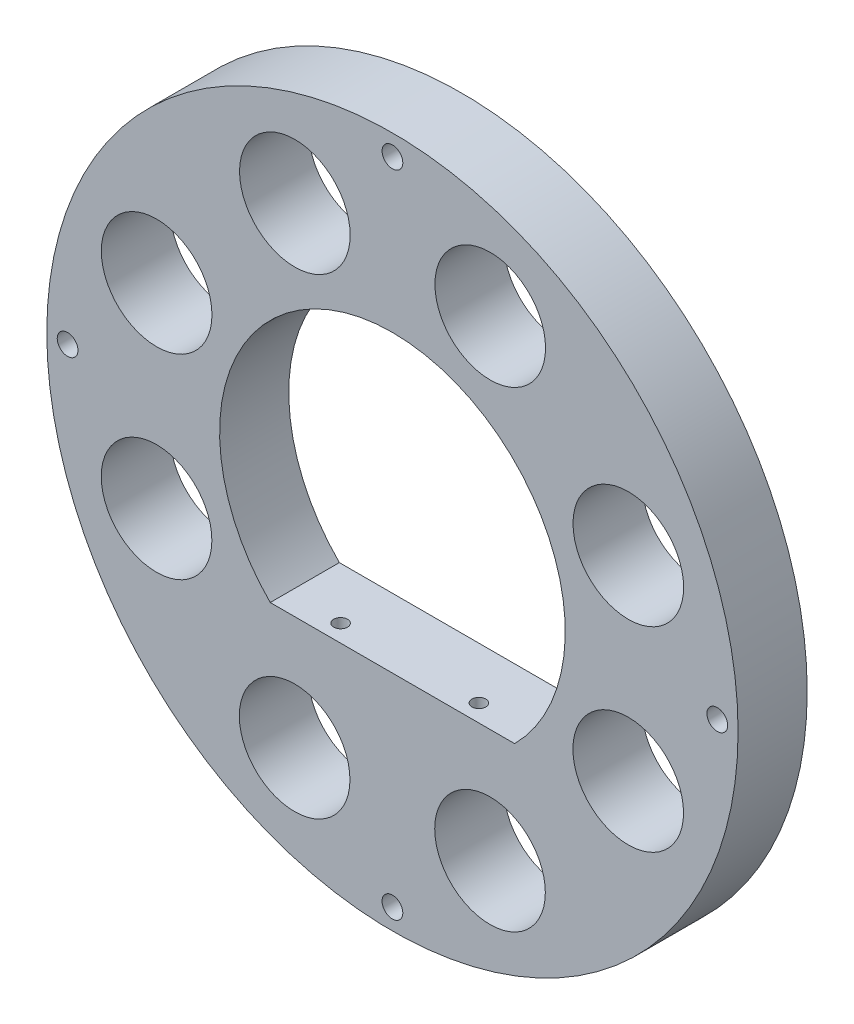
from build123d import *

# Parameters (mm, degrees)
SKETCH1_R           = 50
BOSS_EXTRUDE1_DEPTH = 10
SKETCH3_R           = 8
CUT_EXTRUDE1_DEPTH  = 20
SKETCH4_R           = 1.5
CUT_EXTRUDE2_DEPTH  = 30
SKETCH5_R           = 1
CUT_EXTRUDE3_DEPTH  = 10


with BuildPart() as part:
    # Sketch1 → Boss-Extrude1 (new body)
    with BuildSketch(Plane.XY):
        Circle(SKETCH1_R)
        with BuildLine():
            Line((17.67766953, -17.67766953), (-17.67766953, -17.67766953))
            ThreePointArc((-17.67766953, -17.67766953), (0, 25), (17.67766953, -17.67766953))
        make_face(mode=Mode.SUBTRACT)
    extrude(amount=BOSS_EXTRUDE1_DEPTH)

    # Sketch3 → Cut-Extrude1 (cut)
    with BuildSketch(Plane(origin=(0, 0, 0), x_dir=(-1, 0, 0), z_dir=(0, 0, -1))):
        with Locations((-14.146357726, 34.109474384)):
            Circle(SKETCH3_R)
        with Locations((14.116055163, 34.122026117)):
            Circle(SKETCH3_R)
        with Locations((34.109474384, 14.146357726)):
            Circle(SKETCH3_R)
        with Locations((34.122026117, -14.116055163)):
            Circle(SKETCH3_R)
        with Locations((14.146357726, -34.109474384)):
            Circle(SKETCH3_R)
        with Locations((-14.116055163, -34.122026117)):
            Circle(SKETCH3_R)
        with Locations((-34.109474384, -14.146357726)):
            Circle(SKETCH3_R)
        with Locations((-34.122026117, 14.116055163)):
            Circle(SKETCH3_R)
    extrude(amount=-CUT_EXTRUDE1_DEPTH, mode=Mode.SUBTRACT)

    # Sketch4 → Cut-Extrude2 (cut)
    with BuildSketch(Plane(origin=(0, 0, 0), x_dir=(-1, 0, 0), z_dir=(0, 0, -1))):
        with Locations((0, 46.99)):
            Circle(SKETCH4_R)
        with Locations((46.99, 0)):
            Circle(SKETCH4_R)
        with Locations((0, -46.99)):
            Circle(SKETCH4_R)
        with Locations((-46.99, 0)):
            Circle(SKETCH4_R)
    extrude(amount=-CUT_EXTRUDE2_DEPTH, mode=Mode.SUBTRACT)

    # Sketch5 → Cut-Extrude3 (cut)
    with BuildSketch(Plane(origin=(0, -17.67766953, 0), x_dir=(1, 0, 0), z_dir=(0, 1, 0))):
        with Locations(Location((10, -7.5, 0), (0, 0, 180))):
            Circle(SKETCH5_R)
        with Locations(Location((-10, -7.5, 0), (0, 0, 180))):
            Circle(SKETCH5_R)
    extrude(amount=-CUT_EXTRUDE3_DEPTH, mode=Mode.SUBTRACT)


solid = part.part
